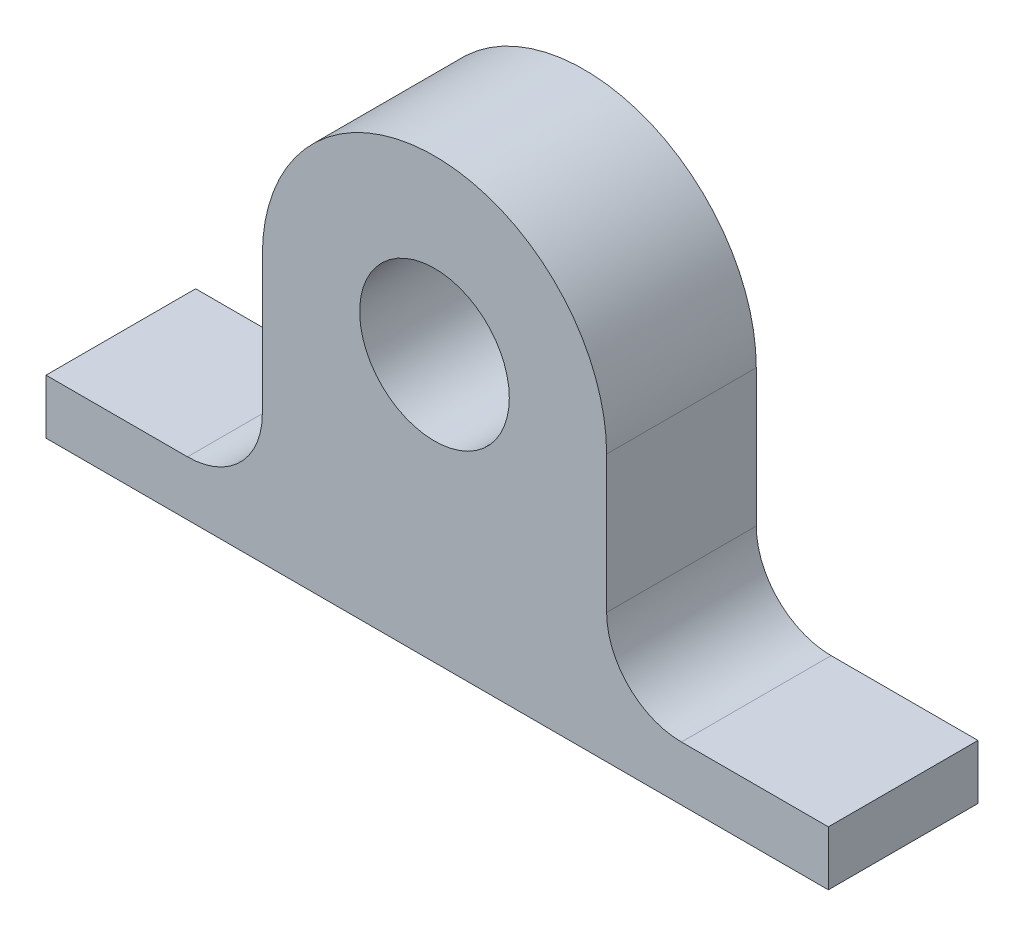
from build123d import *

# Parameters (mm, degrees)
SKETCH1_R           = 4
BOSS_EXTRUDE1_DEPTH = 8


with BuildPart() as part:
    # Sketch1 → Boss-Extrude1 (new body)
    with BuildSketch(Plane.XY):
        with BuildLine():
            Line((-20.767338367, 0), (-20.767338367, 2.918605514))
            Line((-20.767338367, 2.918605514), (-13.202627173, 2.918605514))
            ThreePointArc((-13.202627173, 2.918605514), (-10.374200048, 4.090178389), (-9.202627173, 6.918605514))
            Line((-9.202627173, 6.918605514), (-9.202627173, 14.25))
            ThreePointArc((-9.202627173, 14.25), (0, 23.452627173), (9.202627173, 14.25))
            Line((9.202627173, 14.25), (9.202627173, 6.918605514))
            ThreePointArc((9.202627173, 6.918605514), (10.374200048, 4.090178389), (13.202627173, 2.918605514))
            Line((13.202627173, 2.918605514), (21.055610972, 2.918605514))
            Line((21.055610972, 2.918605514), (21.055610972, 0))
            Line((21.055610972, 0), (-20.767338367, 0))
        make_face()
        with Locations((0, 14.25)):
            Circle(SKETCH1_R, mode=Mode.SUBTRACT)
    extrude(amount=BOSS_EXTRUDE1_DEPTH)


solid = part.part
